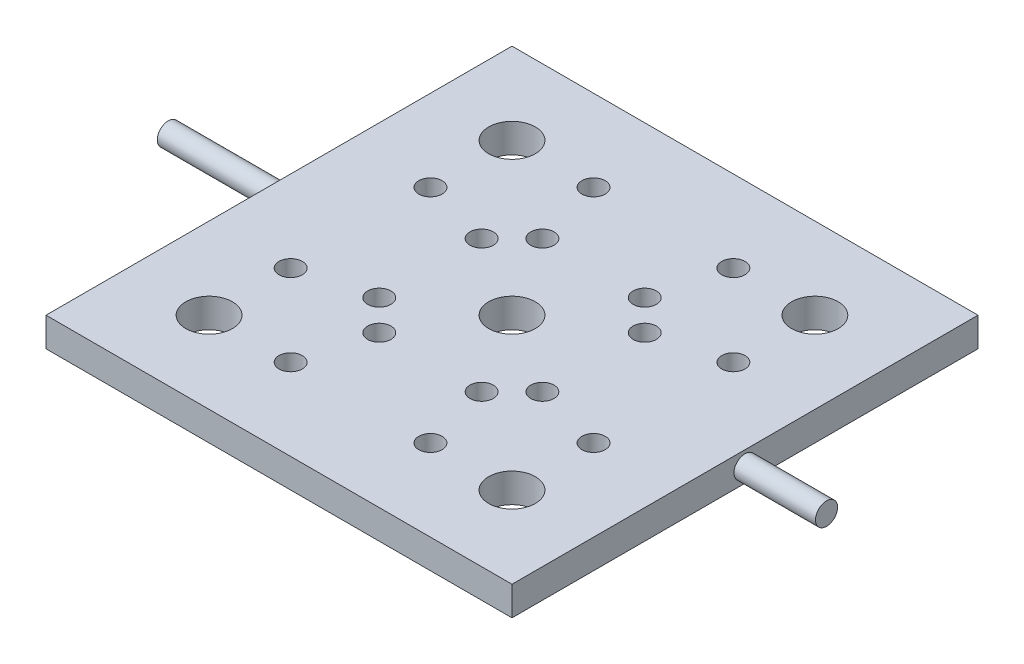
from build123d import *

# Parameters (mm, degrees)
SKETCH1_W           = 50.8
SKETCH1_H           = 50.8
BOSS_EXTRUDE1_DEPTH = 1.5875
SKETCH3_R           = 1.2065
BOSS_EXTRUDE2_DEPTH = 8.89
SKETCH4_R           = 2.54
SKETCH4_R_2         = 1.27
CUT_EXTRUDE1_DEPTH  = 43.790708396
BOSS_EXTRUDE3_START = 12.065
SKETCH5_R           = 1.2065
BOSS_EXTRUDE3_DEPTH = 12.065


with BuildPart() as part:
    # Sketch1 → Boss-Extrude1 (new, symmetric)
    with BuildSketch(Plane(origin=(0, 0, 0), x_dir=(1, 0, 0), z_dir=(0, 1, 0))):
        Rectangle(SKETCH1_W, SKETCH1_H)
    extrude(amount=BOSS_EXTRUDE1_DEPTH, both=True)

    # Sketch3 → Boss-Extrude2 (add)
    with BuildSketch(Plane(origin=(25.4, 0, 0), x_dir=(0, 0, -1), z_dir=(1, 0, 0))):
        with Locations(Location((0, 0, 0), (0, 0, 180))):
            Circle(SKETCH3_R)
    extrude(amount=BOSS_EXTRUDE2_DEPTH)

    # Sketch4 → Cut-Extrude1 (cut, through all)
    with BuildSketch(Plane(origin=(0, 1.5875, 0), x_dir=(1, 0, 0), z_dir=(0, 1, 0))):
        with Locations(Location((0, 0, 0), (0, 0, 270))):
            Circle(SKETCH4_R)
        with Locations(Location((-16.51, 16.51, 0), (0, 0, 270))):
            Circle(SKETCH4_R)
        with Locations(Location((16.51, 16.51, 0), (0, 0, 270))):
            Circle(SKETCH4_R)
        with Locations(Location((16.51, -16.51, 0), (0, 0, 270))):
            Circle(SKETCH4_R)
        with Locations(Location((-16.51, -16.51, 0), (0, 0, 270))):
            Circle(SKETCH4_R)
        with Locations(Location((-16.51, 7.62, 0), (0, 0, 270))):
            Circle(SKETCH4_R_2)
        with Locations(Location((-7.62, 16.51, 0), (0, 0, 270))):
            Circle(SKETCH4_R_2)
        with Locations(Location((7.62, 16.51, 0), (0, 0, 270))):
            Circle(SKETCH4_R_2)
        with Locations(Location((-16.51, -7.62, 0), (0, 0, 270))):
            Circle(SKETCH4_R_2)
        with Locations(Location((7.62, -16.51, 0), (0, 0, 90))):
            Circle(SKETCH4_R_2)
        with Locations(Location((-7.62, -16.51, 0), (0, 0, 90))):
            Circle(SKETCH4_R_2)
        with Locations(Location((16.51, -7.62, 0), (0, 0, 90))):
            Circle(SKETCH4_R_2)
        with Locations(Location((16.51, 7.62, 0), (0, 0, 90))):
            Circle(SKETCH4_R_2)
        with Locations(Location((5.578227154, 8.89, 0), (0, 0, 270))):
            Circle(SKETCH4_R_2)
        with Locations(Location((-5.578227154, 8.89, 0), (0, 0, 270))):
            Circle(SKETCH4_R_2)
        with Locations(Location((8.89, -5.578227154, 0), (0, 0, 270))):
            Circle(SKETCH4_R_2)
        with Locations(Location((8.89, 5.578227154, 0), (0, 0, 270))):
            Circle(SKETCH4_R_2)
        with Locations(Location((-5.578227154, -8.89, 0), (0, 0, 270))):
            Circle(SKETCH4_R_2)
        with Locations(Location((5.578227154, -8.89, 0), (0, 0, 270))):
            Circle(SKETCH4_R_2)
        with Locations(Location((-8.89, 5.578227154, 0), (0, 0, 270))):
            Circle(SKETCH4_R_2)
        with Locations(Location((-8.89, -5.578227154, 0), (0, 0, 270))):
            Circle(SKETCH4_R_2)
    extrude(amount=-CUT_EXTRUDE1_DEPTH, mode=Mode.SUBTRACT)

    # Sketch5 → Boss-Extrude3 (add)
    with BuildSketch(Plane.ZY.offset(25.4).offset(BOSS_EXTRUDE3_START)):
        Circle(SKETCH5_R)
    extrude(amount=-BOSS_EXTRUDE3_DEPTH)


solid = part.part
